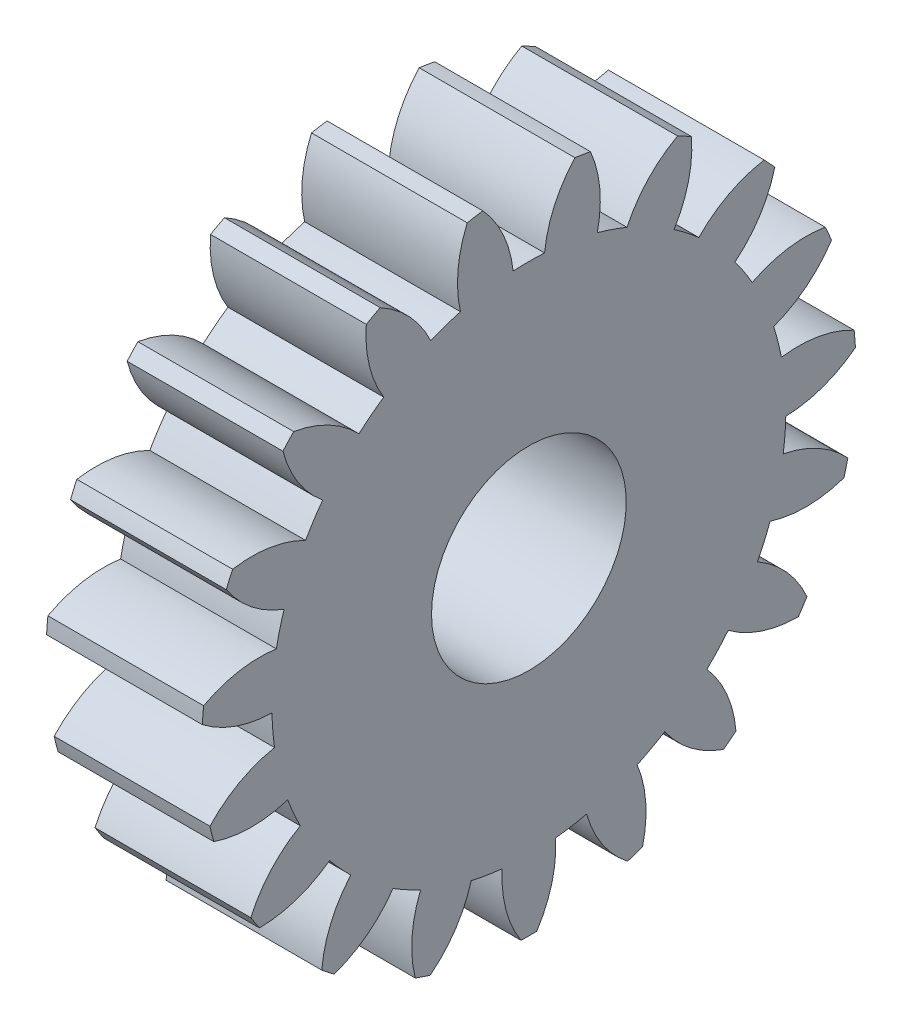
from build123d import *

# Parameters (mm, degrees)
BASPROSKE_W     = 4
BASPROSKE_H     = 8.4
TOOTHCUT_DEPTH  = 13.534751693
TEETHCUTS_COUNT = 19
TEETHCUTS_ANGLE = 341.052631579
BORSKE_R        = 2.5
BORE_DEPTH      = 50.0000508


with BuildPart() as part:
    # BasProSke → Base-Revolve (revolve)
    with BuildSketch(Plane(origin=(0, 0, 0), x_dir=(1, 0, 0), z_dir=(0, 1, 0)), mode=Mode.PRIVATE) as base_revolve_sk:
        with Locations((2, 4.2)):
            Rectangle(BASPROSKE_W, BASPROSKE_H)
    revolve(base_revolve_sk.sketch.rotate(Axis((-10, 0, 0), (1, 0, 0)), 180), axis=Axis((-10, 0, 0), (1, 0, 0)))

    # TooCutSke → ToothCut (cut, through all)
    with BuildSketch(Plane(origin=(0, 0, 0), x_dir=(0, 0, -1), z_dir=(1, 0, 0))):
        with BuildLine():
            ThreePointArc((0.403390264, 6.586659039), (0, 6.599), (-0.403390264, 6.586659039))
            ThreePointArc((-0.403390264, 6.586659039), (-0.660693378, 7.527871127), (-1.202927595, 8.339084504))
            ThreePointArc((-1.202927595, 8.339084504), (0, 8.4254), (1.202927595, 8.339084504))
            ThreePointArc((1.202927595, 8.339084504), (0.660693378, 7.527871127), (0.403390264, 6.586659039))
        make_face()
    toothcut = extrude(amount=TOOTHCUT_DEPTH, mode=Mode.SUBTRACT)

    # TeethCuts: ToothCut ×19 about axis
    teethcuts_axis = Axis((-10, 0, 0), (1, 0, 0))
    for i in range(1, TEETHCUTS_COUNT):
        add(toothcut.rotate(teethcuts_axis, i * TEETHCUTS_ANGLE / (TEETHCUTS_COUNT - 1)), mode=Mode.SUBTRACT)

    # BorSke → Bore (cut, symmetric)
    with BuildSketch(Plane(origin=(0, 0, 0), x_dir=(0, 0, -1), z_dir=(1, 0, 0))):
        with Locations(Location((0, 0, 0), (0, 0, 180))):
            Circle(BORSKE_R)
    extrude(amount=BORE_DEPTH, both=True, mode=Mode.SUBTRACT)


solid = part.part
